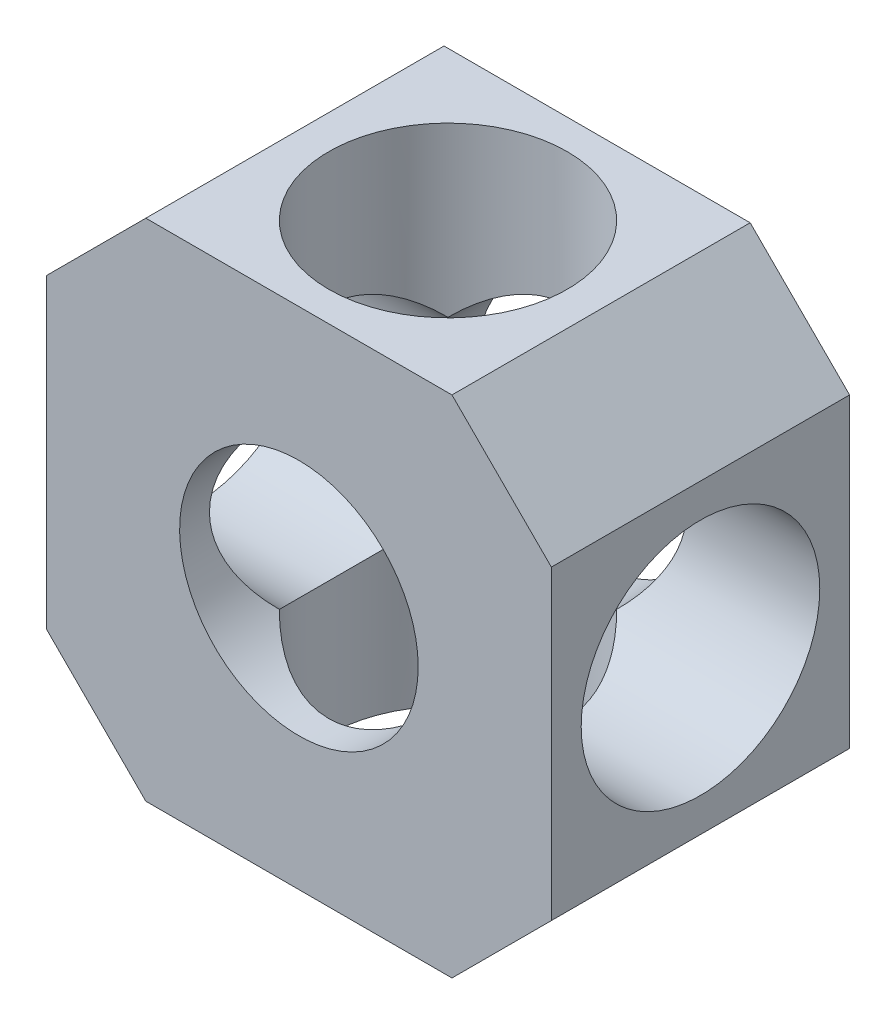
from build123d import *

# Parameters (mm, degrees)
SKETCH2_R           = 6
BOSS_EXTRUDE2_DEPTH = 15
CIRPATTERN1_COUNT   = 2
CIRPATTERN1_ANGLE   = 90


with BuildPart() as part:
    # Sketch2 → Boss-Extrude2 (new body)
    with BuildSketch(Plane.XY):
        Polygon((-12.7, 7.7), (-7.7, 12.7), (7.7, 12.7), (12.7, 7.7), (12.7, -7.7), (7.7, -12.7), (-7.7, -12.7), (-12.7, -7.7), align=None)
        Circle(SKETCH2_R, mode=Mode.SUBTRACT)
    extrude(amount=BOSS_EXTRUDE2_DEPTH)

    # Sketch4 → Ø12.0 (12) Diameter Hole1 (revolve, cut)
    with BuildSketch(Plane(origin=(0, 12.7, 7.5), x_dir=(0, 0, 1), z_dir=(1, 0, 0))):
        Polygon((0, 0), (0, 33.925163714), (6, 30.32), (6, 0), align=None)
    f_12_0_12_diameter_hole1 = revolve(axis=Axis((0, 19.05, 7.5), (0, -1, 0)), mode=Mode.SUBTRACT)

    # CirPattern1: Ø12.0 (12) Diameter Hole1 ×2 about axis
    cirpattern1_axis = Axis((0, 0, 0), (0, 0, 1))
    for i in range(1, CIRPATTERN1_COUNT):
        add(f_12_0_12_diameter_hole1.rotate(cirpattern1_axis, i * CIRPATTERN1_ANGLE / (CIRPATTERN1_COUNT - 1)), mode=Mode.SUBTRACT)


solid = part.part
